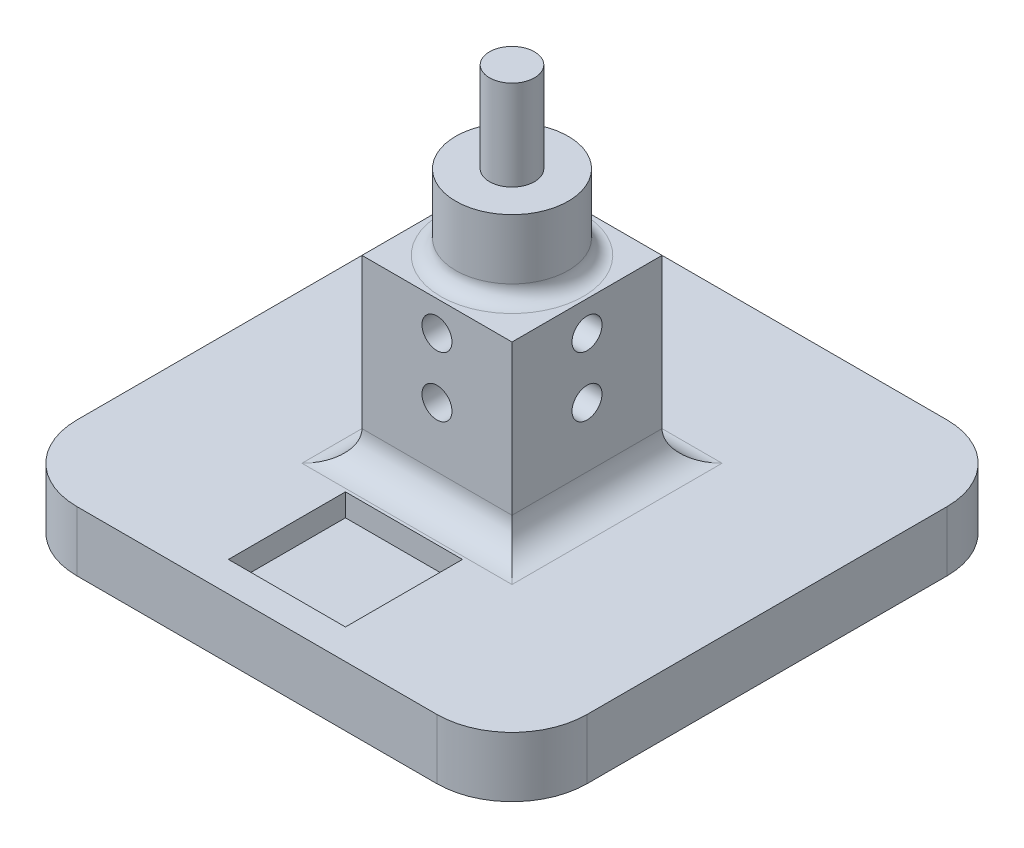
from build123d import *

# Parameters (mm, degrees)
SKETCH_1_R               = 7.5
EXTRUDE_1_DEPTH          = 10
SKETCH_2_W               = 20
SKETCH_2_H               = 20
EXTRUDE_2_DEPTH          = 24
SKETCH_3_W               = 68
SKETCH_3_H               = 68
EXTRUDE_3_DEPTH          = 8
FILLET_1_R               = 10
SKETCH_4_R               = 2
CUT_EXTRUDE_1_DEPTH      = 23
PATTERN_CIRCULAR_1_COUNT = 2
PATTERN_CIRCULAR_1_ANGLE = 90
SKETCH_5_R               = 5
CUT_EXTRUDE_2_DEPTH      = 31
FILLET_3_R               = 4
SKETCH_6_W               = 15.6
SKETCH_6_H               = 15.6
CUT_EXTRUDE_3_DEPTH      = 3
SKETCH_7_R               = 3
EXTRUDE_4_DEPTH          = 12
FILLET_4_R               = 2


with BuildPart() as part:
    # 草图1 → 凸台-拉伸1 (new body)
    with BuildSketch(Plane(origin=(0, 0, 0), x_dir=(1, 0, 0), z_dir=(0, 1, 0))):
        with Locations(Location((0, 0, 0), (0, 0, 270))):
            Circle(SKETCH_1_R)
    extrude(amount=EXTRUDE_1_DEPTH)

    # 草图2 → 凸台-拉伸2 (add)
    with BuildSketch(Plane.XZ):
        Rectangle(SKETCH_2_W, SKETCH_2_H)
    extrude(amount=EXTRUDE_2_DEPTH)

    # 草图3 → 凸台-拉伸3 (add)
    with BuildSketch(Plane.XZ.offset(24)):
        Rectangle(SKETCH_3_W, SKETCH_3_H)
    extrude(amount=EXTRUDE_3_DEPTH)

    # 圆角1
    fillet_1_edges = [part.edges().sort_by_distance(p)[0] for p in [
        (34, -28, -34),
        (34, -28, 34),
        (-34, -28, 34),
        (-34, -28, -34),
    ]]
    fillet(fillet_1_edges, radius=FILLET_1_R)

    # 草图4 → 切除-拉伸1 (cut)
    with BuildSketch(Plane(origin=(10, 0, 0), x_dir=(0, 0, -1), z_dir=(1, 0, 0))):
        with Locations((0, -4)):
            Circle(SKETCH_4_R)
        with Locations((0, -12)):
            Circle(SKETCH_4_R)
    cut_extrude_1 = extrude(amount=-CUT_EXTRUDE_1_DEPTH, mode=Mode.SUBTRACT)

    # 阵列(圆周)1: 切除-拉伸1 ×2 about axis
    pattern_circular_1_axis = Axis((0, 10, 0), (0, -1, 0))
    for i in range(1, PATTERN_CIRCULAR_1_COUNT):
        add(cut_extrude_1.rotate(pattern_circular_1_axis, i * PATTERN_CIRCULAR_1_ANGLE / (PATTERN_CIRCULAR_1_COUNT - 1)), mode=Mode.SUBTRACT)

    # 草图5 → 切除-拉伸2 (cut)
    with BuildSketch(Plane.XZ.offset(32)):
        with Locations(Location((0, 0, 0), (0, 0, 270))):
            Circle(SKETCH_5_R)
    extrude(amount=-CUT_EXTRUDE_2_DEPTH, mode=Mode.SUBTRACT)

    # 圆角3
    fillet_3_edges = [part.edges().sort_by_distance(p)[0] for p in [
        (10, -24, 0),
        (0, -24, 10),
        (-10, -24, 0),
        (0, -24, -10),
    ]]
    fillet(fillet_3_edges, radius=FILLET_3_R)

    # 草图6 → 切除-拉伸3 (cut)
    with BuildSketch(Plane(origin=(0, -24, 0), x_dir=(1, 0, 0), z_dir=(0, 1, 0))):
        with Locations((0, -22.2)):
            Rectangle(SKETCH_6_W, SKETCH_6_H)
    extrude(amount=-CUT_EXTRUDE_3_DEPTH, mode=Mode.SUBTRACT)

    # 草图7 → 凸台-拉伸4 (add)
    with BuildSketch(Plane(origin=(0, 10, 0), x_dir=(1, 0, 0), z_dir=(0, 1, 0))):
        with Locations(Location((0, 0, 0), (0, 0, 270))):
            Circle(SKETCH_7_R)
    extrude(amount=EXTRUDE_4_DEPTH)

    # 圆角4
    fillet_4_edges = [part.edges().sort_by_distance(p)[0] for p in [
        (0, 0, -7.5),
    ]]
    fillet(fillet_4_edges, radius=FILLET_4_R)


solid = part.part
